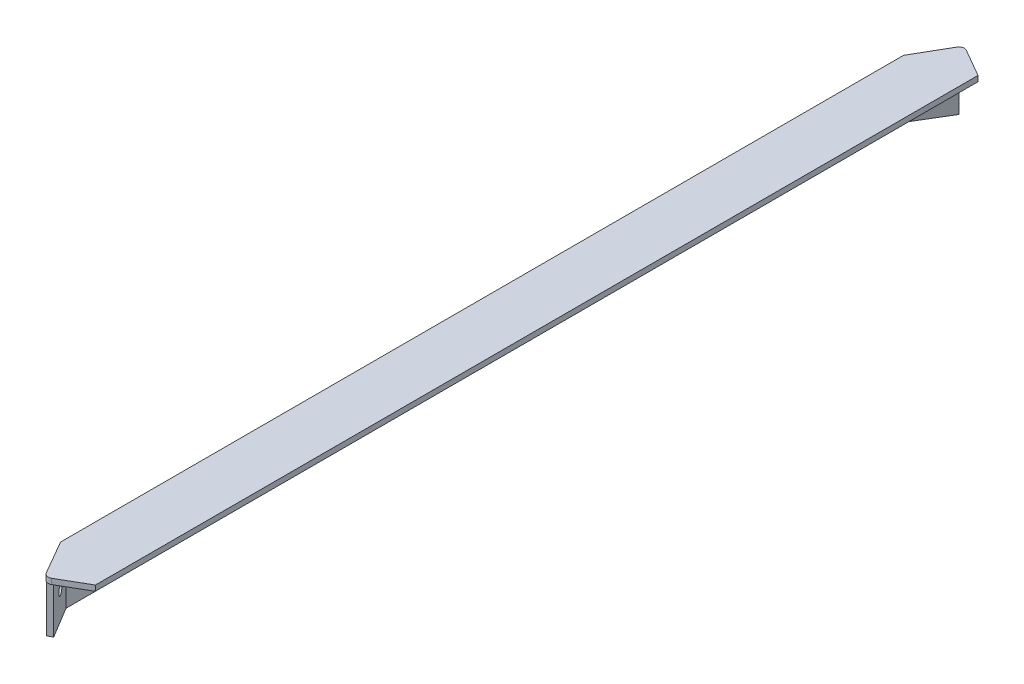
from build123d import *

# Parameters (mm, degrees)
BOSS_EXTRUDE1_DEPTH = 540
BOSS_EXTRUDE2_DEPTH = 63
BOSS_EXTRUDE4_DEPTH = 7
SKETCH10_R          = 6
CUT_EXTRUDE3_DEPTH  = 7
FILLET5_R           = 5


with BuildPart() as part:
    # Sketch1 → Boss-Extrude1 (new body)
    with BuildSketch(Plane.XY):
        Polygon((0, 0), (0, 70), (70, 70), (70, 63), (7, 63), (7, 0), align=None)
    extrude(amount=BOSS_EXTRUDE1_DEPTH)

    # Sketch2 → Boss-Extrude2 (add)
    with BuildSketch(Plane(origin=(0, 0, 0), x_dir=(1, 0, 0), z_dir=(0, 1, 0))):
        Polygon((0, -540), (25, -583.301270189), (31.062177826, -579.801270189), (7, -540), align=None)
    extrude(amount=BOSS_EXTRUDE2_DEPTH)

    # Sketch9 → Boss-Extrude4 (add)
    with BuildSketch(Plane(origin=(0, 63, 0), x_dir=(1, 0, 0), z_dir=(0, 1, 0))):
        with BuildLine():
            Line((0, -540), (25, -583.301270189))
            ThreePointArc((25, -583.301270189), (29.250444511, -586.562750973), (34.562177826, -585.863448016))
            Line((34.562177826, -585.863448016), (70, -565.403411844))
            Line((70, -565.403411844), (70, -540))
            Line((70, -540), (0, -540))
        make_face()
    extrude(amount=BOSS_EXTRUDE4_DEPTH)

    # Sketch10 → Cut-Extrude3 (cut)
    with BuildSketch(Plane(origin=(-233.953556616, 0, 141.438503236), x_dir=(-0.5173609804017633, 0, -0.8557672674026079), z_dir=(0.8557672674026079, 0, -0.5173609804017633))):
        with Locations((-487.2453074, 35)):
            Circle(SKETCH10_R)
    extrude(amount=-CUT_EXTRUDE3_DEPTH, mode=Mode.SUBTRACT)

    # Fillet5
    fillet5_edges = [part.edges().sort_by_distance(p)[0] for p in [
        (7, 63, 270),
        (19.031088913, 63, 559.900635095),
    ]]
    fillet(fillet5_edges, radius=FILLET5_R)

    # Mirror6: part across plane


with BuildPart() as part_1:
    add(part.part)
    add(part.part.mirror(Plane.XY))


solid = part_1.part
